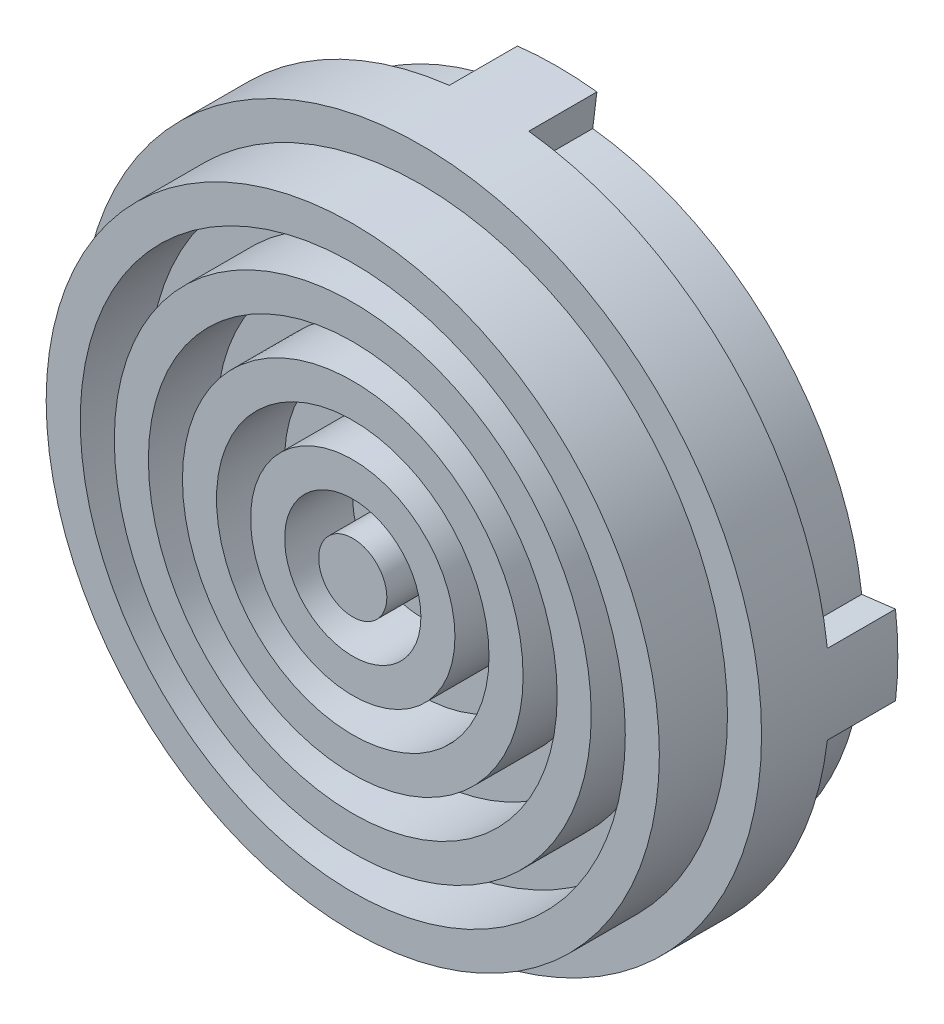
from build123d import *
from build123d.topology import SkipClean

# Parameters (mm, degrees)
SKETCH1_R           = 150
BOSS_EXTRUDE1_DEPTH = 30
SKETCH2_R           = 135
SKETCH2_R_2         = 120
SKETCH2_R_3         = 105
SKETCH2_R_4         = 90
SKETCH2_R_5         = 75
SKETCH2_R_6         = 60
SKETCH2_R_7         = 45
SKETCH2_R_8         = 30
SKETCH2_R_9         = 15
BOSS_EXTRUDE2_DEPTH = 30
BOSS_EXTRUDE3_START = 30
SKETCH3_R           = 135
SKETCH3_R_2         = 115
SKETCH3_R_3         = 75
SKETCH3_R_4         = 55
SKETCH3_R_5         = 35
SKETCH3_R_6         = 15
BOSS_EXTRUDE3_DEPTH = 30
BOSS_EXTRUDE4_START = 30
BOSS_EXTRUDE4_DEPTH = 30


with BuildPart() as part:
    # Sketch1 → Boss-Extrude1 (new body)
    with BuildSketch(Plane.XY):
        Circle(SKETCH1_R)
    extrude(amount=BOSS_EXTRUDE1_DEPTH)

    # Sketch2 → Boss-Extrude2 (add)
    # profile 1 of 5: a face of its own
    with BuildSketch(Plane.XY.offset(30)):
        Circle(SKETCH2_R)
        Circle(SKETCH2_R_2, mode=Mode.SUBTRACT)
    # profile 2 of 5: a face of its own
    with BuildSketch(Plane.XY.offset(30)):
        Circle(SKETCH2_R_3)
        Circle(SKETCH2_R_4, mode=Mode.SUBTRACT)
    # profile 3 of 5: a face of its own
    with BuildSketch(Plane.XY.offset(30)):
        Circle(SKETCH2_R_5)
        Circle(SKETCH2_R_6, mode=Mode.SUBTRACT)
    # profile 4 of 5: a face of its own
    with BuildSketch(Plane.XY.offset(30)):
        Circle(SKETCH2_R_7)
        Circle(SKETCH2_R_8, mode=Mode.SUBTRACT)
    # profile 5 of 5: a face of its own
    with BuildSketch(Plane.XY.offset(30)):
        Circle(SKETCH2_R_9)
    extrude(amount=BOSS_EXTRUDE2_DEPTH)

    # Sketch3 → Boss-Extrude3 (add)
    # profile 1 of 3: a face of its own
    with BuildSketch(Plane(origin=(0, 0, 0), x_dir=(-1, 0, 0), z_dir=(0, 0, -1)).offset(BOSS_EXTRUDE3_START)):
        with Locations(Location((0, 0, 0), (0, 0, 180))):
            Circle(SKETCH3_R)
        Circle(SKETCH3_R_2, mode=Mode.SUBTRACT)
    # profile 2 of 3: a face of its own
    with BuildSketch(Plane(origin=(0, 0, 0), x_dir=(-1, 0, 0), z_dir=(0, 0, -1)).offset(BOSS_EXTRUDE3_START)):
        with Locations(Location((0, 0, 0), (0, 0, 180))):
            Circle(SKETCH3_R_3)
        Circle(SKETCH3_R_4, mode=Mode.SUBTRACT)
    # profile 3 of 3: a face of its own
    with BuildSketch(Plane(origin=(0, 0, 0), x_dir=(-1, 0, 0), z_dir=(0, 0, -1)).offset(BOSS_EXTRUDE3_START)):
        with Locations(Location((0, 0, 0), (0, 0, 180))):
            Circle(SKETCH3_R_5)
        with Locations(Location((0, 0, 0), (0, 0, 180))):
            Circle(SKETCH3_R_6, mode=Mode.SUBTRACT)
    extrude(amount=-BOSS_EXTRUDE3_DEPTH)

    # Sketch4 → Boss-Extrude4 (add)
    with SkipClean():  # the faces are left unmerged after this step: merging them gives an invalid solid
        with BuildSketch(Plane(origin=(0, 0, 0), x_dir=(-1, 0, 0), z_dir=(0, 0, -1)).offset(BOSS_EXTRUDE4_START)):
            with BuildLine():
                Line((-5.347315923, 50), (5.347315923, 50))
                Line((5.347315923, 50), (17.5, 148.975669154))
                ThreePointArc((17.5, 148.975669154), (0, 150), (-17.5, 148.975669154))
                Line((-17.5, 148.975669154), (-5.347315923, 50))
            make_face()
            with BuildLine():
                Line((50, 5.347315923), (148.975669154, 17.5))
                ThreePointArc((148.975669154, 17.5), (150, 0), (148.975669154, -17.5))
                Line((148.975669154, -17.5), (50, -5.347315923))
                Line((50, -5.347315923), (50, 5.347315923))
            make_face()
            with BuildLine():
                Line((5.347315923, -50), (17.5, -148.975669154))
                ThreePointArc((17.5, -148.975669154), (0, -150), (-17.5, -148.975669154))
                Line((-17.5, -148.975669154), (-5.347315923, -50))
                Line((-5.347315923, -50), (5.347315923, -50))
            make_face()
            with BuildLine():
                Line((-50, -5.347315923), (-148.975669154, -17.5))
                ThreePointArc((-148.975669154, -17.5), (-150, 0), (-148.975669154, 17.5))
                Line((-148.975669154, 17.5), (-50, 5.347315923))
                Line((-50, 5.347315923), (-50, -5.347315923))
            make_face()
        extrude(amount=-BOSS_EXTRUDE4_DEPTH)


solid = part.part
